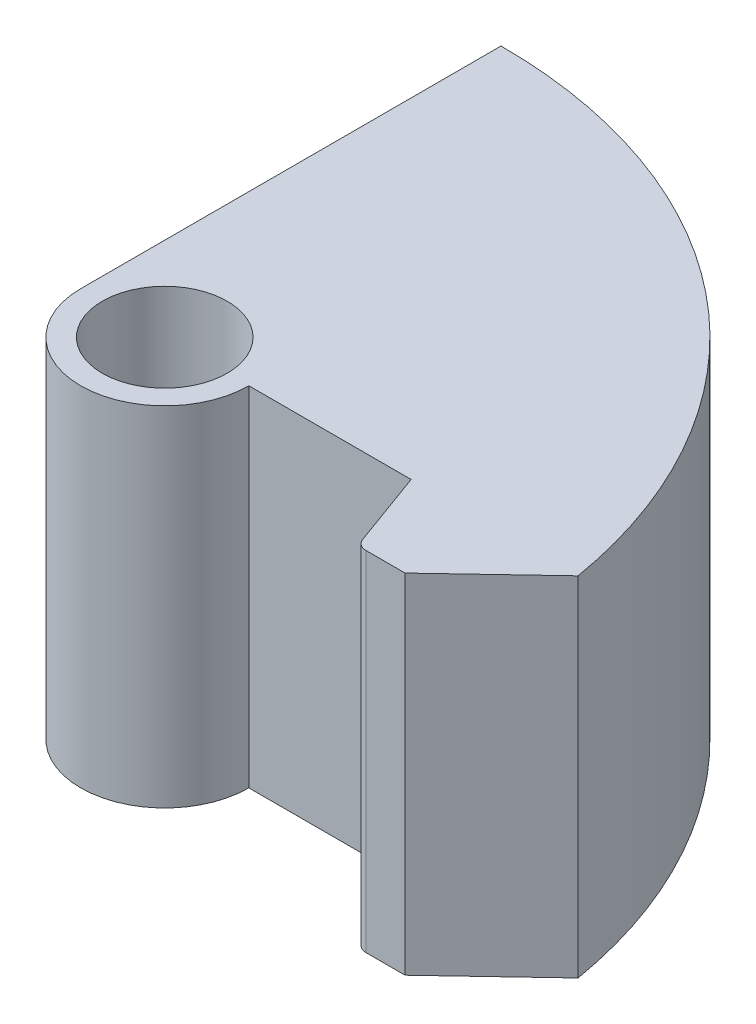
from build123d import *

# Parameters (mm, degrees)
SKETCH2_R           = 3.5
SKETCH2_R_2         = 2.6
BOSS_EXTRUDE1_DEPTH = 14.6
SKETCH4_W           = 39.254699086
SKETCH4_H           = 35.178673269
CUT_EXTRUDE1_DEPTH  = 0.1
BOSS_EXTRUDE5_DEPTH = 14.5


with BuildPart() as part:
    # Sketch2 → Boss-Extrude1 (new body)
    # profile 1 of 2: a face of its own
    with BuildSketch(Plane(origin=(0, 0, 0), x_dir=(1, 0, 0), z_dir=(0, 1, 0))):
        with BuildLine():
            Line((-3.5, 17.5), (-3.5, 0))
            ThreePointArc((-3.5, 0), (0, 3.5), (3.5, 0))
            Line((3.5, 0), (17.206279241, 0))
            ThreePointArc((17.206279241, 0), (10.055441712, 12.539014932), (-3.5, 17.5))
        make_face()
    # profile 2 of 2: a face of its own
    with BuildSketch(Plane(origin=(0, 0, 0), x_dir=(1, 0, 0), z_dir=(0, 1, 0))):
        Circle(SKETCH2_R)
        with Locations(Location((0, 0, 0), (0, 0, 270))):
            Circle(SKETCH2_R_2, mode=Mode.SUBTRACT)
    extrude(amount=BOSS_EXTRUDE1_DEPTH)

    # Sketch4 → Cut-Extrude1 (cut)
    with BuildSketch(Plane(origin=(0, 14.6, 0), x_dir=(1, 0, 0), z_dir=(0, 1, 0))):
        with Locations((10.965886391, 4.797703191)):
            Rectangle(SKETCH4_W, SKETCH4_H)
    extrude(amount=-CUT_EXTRUDE1_DEPTH, mode=Mode.SUBTRACT)

    # Sketch7 → Boss-Extrude5 (add)
    with BuildSketch(Plane(origin=(0, 0, 0), x_dir=(-1, 0, 0), z_dir=(0, -1, 0))):
        with BuildLine():
            ThreePointArc((-11.881011918, -3.5), (-11.5942237, -3.409576022), (-11.411165608, -3.171010072))
            Line((-11.411165608, -3.171010072), (-10.257012329, 0))
            Line((-10.257012329, 0), (-13.505011507, 0))
            Line((-13.505011507, 0), (-17.206279241, 0))
            Line((-17.206279241, 0), (-13.505011507, -3.5))
            Line((-13.505011507, -3.5), (-11.881011918, -3.5))
        make_face()
    extrude(amount=-BOSS_EXTRUDE5_DEPTH)


solid = part.part
